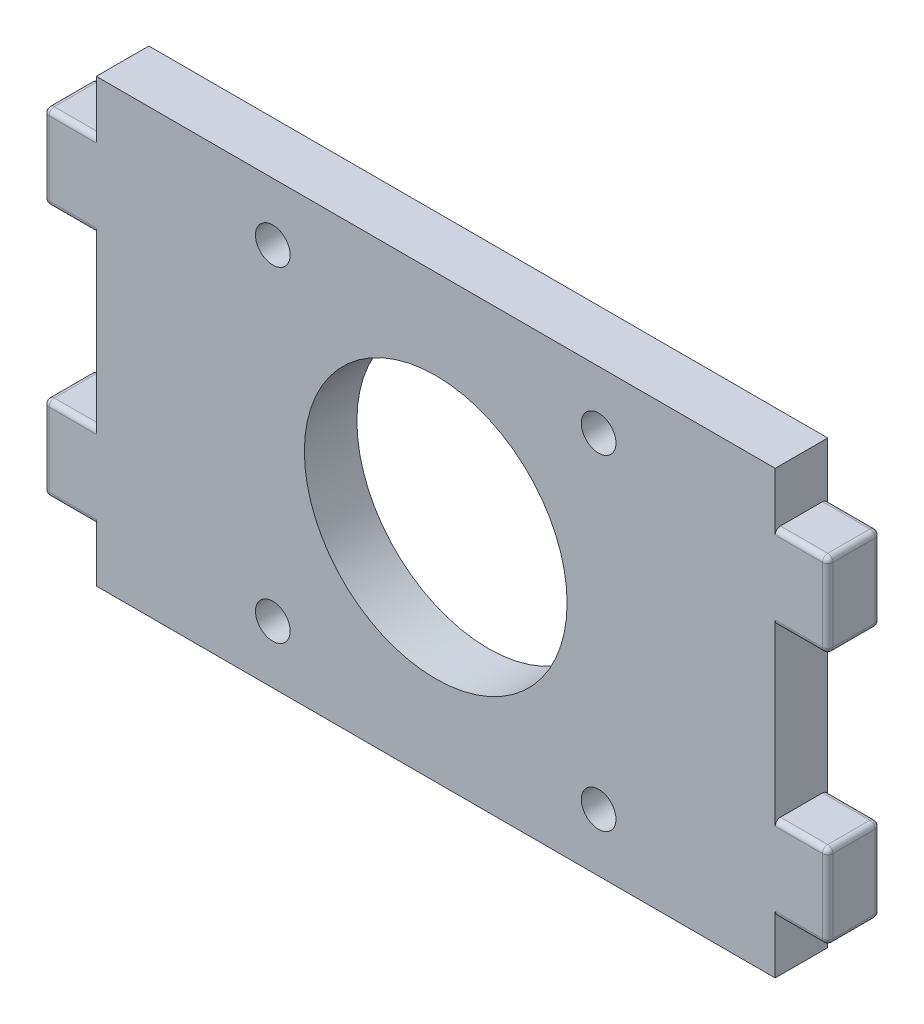
from build123d import *

# Parameters (mm, degrees)
CROQUIS1_W               = 64.6
CROQUIS1_H               = 42
CROQUIS1_R               = 1.65
CROQUIS1_R_2             = 12.5
SALIENTE_EXTRUIR1_DEPTH  = 5
CROQUIS2_W               = 5
CROQUIS2_H               = 8
SALIENTE_EXTRUIR2_DEPTH  = 5
REDONDEO1_R              = 0.5
REDONDEO1_OF_SIMETR_A1_R = 0.5


with BuildPart() as part:
    # Croquis1 → Saliente-Extruir1 (new body)
    with BuildSketch(Plane.XY):
        Rectangle(CROQUIS1_W, CROQUIS1_H)
        with Locations((-15.5, 15.5)):
            Circle(CROQUIS1_R, mode=Mode.SUBTRACT)
        with Locations((15.5, 15.5)):
            Circle(CROQUIS1_R, mode=Mode.SUBTRACT)
        Circle(CROQUIS1_R_2, mode=Mode.SUBTRACT)
        with Locations((-15.5, -15.5)):
            Circle(CROQUIS1_R, mode=Mode.SUBTRACT)
        with Locations((15.5, -15.5)):
            Circle(CROQUIS1_R, mode=Mode.SUBTRACT)
    extrude(amount=SALIENTE_EXTRUIR1_DEPTH)

    # Croquis2 → Saliente-Extruir2 (add)
    with BuildSketch(Plane.ZY.offset(32.3)):
        with Locations((2.5, 12)):
            Rectangle(CROQUIS2_W, CROQUIS2_H)
        with Locations((2.5, -12)):
            Rectangle(CROQUIS2_W, CROQUIS2_H)
    saliente_extruir2 = extrude(amount=SALIENTE_EXTRUIR2_DEPTH)

    # Redondeo1
    redondeo1_edges = [part.edges().sort_by_distance(p)[0] for p in [
        (-34.8, 16, 0),
        (-34.8, 8, 0),
        (-34.8, 8, 5),
        (-34.8, 16, 5),
        (-37.3, 12, 0),
        (-37.3, 8, 2.5),
        (-37.3, 12, 5),
        (-37.3, 16, 2.5),
        (-34.8, -8, 0),
        (-34.8, -16, 0),
        (-34.8, -16, 5),
        (-34.8, -8, 5),
        (-37.3, -12, 0),
        (-37.3, -16, 2.5),
        (-37.3, -12, 5),
        (-37.3, -8, 2.5),
    ]]
    fillet(redondeo1_edges, radius=REDONDEO1_R)

    # Simetría1: Saliente-Extruir2 across plane
    add(saliente_extruir2.mirror(Plane(origin=(0, 0, 0), x_dir=(0, 0, 1), z_dir=(1, 0, 0))))

    # Redondeo1 of Simetría1
    redondeo1_of_simetr_a1_edges = [part.edges().sort_by_distance(p)[0] for p in [
        (34.8, 16, 0),
        (34.8, 8, 0),
        (34.8, 8, 5),
        (34.8, 16, 5),
        (37.3, 12, 0),
        (37.3, 8, 2.5),
        (37.3, 12, 5),
        (37.3, 16, 2.5),
        (34.8, -8, 0),
        (34.8, -16, 0),
        (34.8, -16, 5),
        (34.8, -8, 5),
        (37.3, -12, 0),
        (37.3, -16, 2.5),
        (37.3, -12, 5),
        (37.3, -8, 2.5),
    ]]
    fillet(redondeo1_of_simetr_a1_edges, radius=REDONDEO1_OF_SIMETR_A1_R)


solid = part.part
